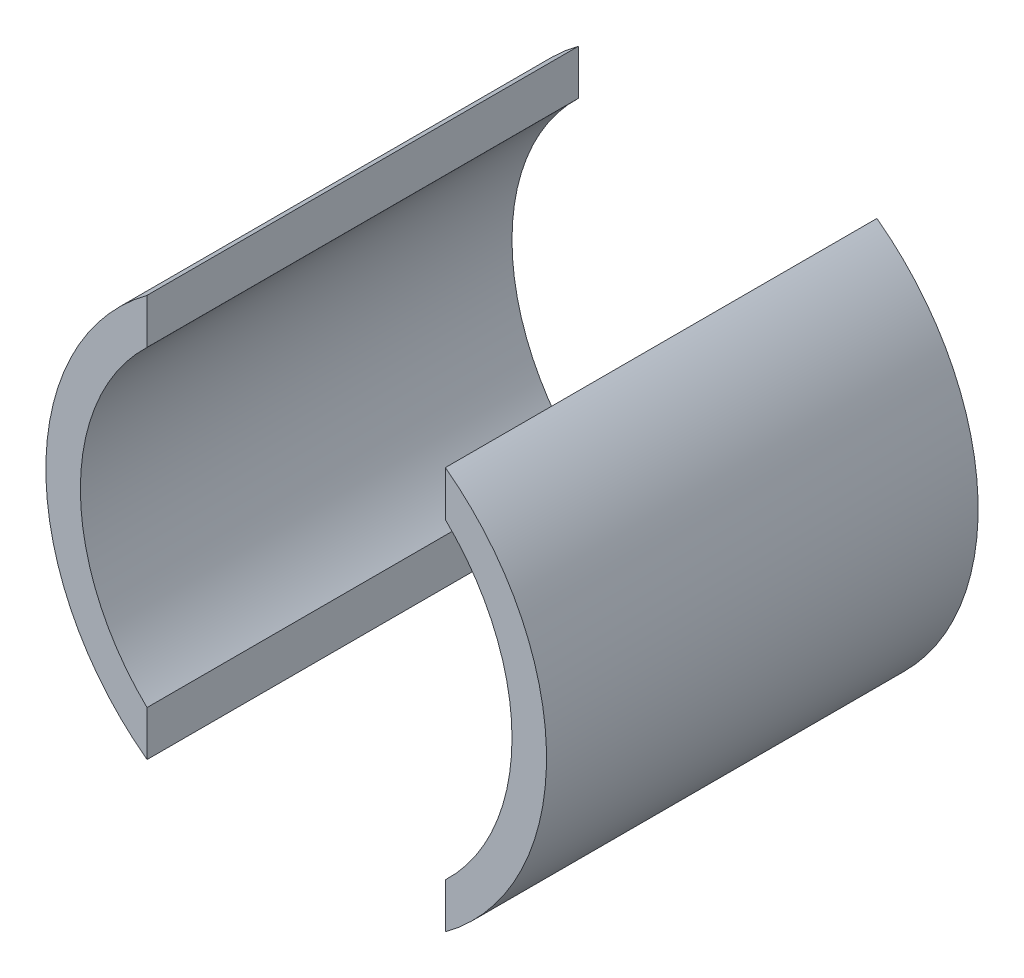
from build123d import *

# Parameters (mm, degrees)
BOSS_EXTRUDE1_DEPTH   = 50
BOSS_EXTRUDE1_2_DEPTH = 50


with BuildPart() as part:
    # Sketch1 → Boss-Extrude1 (new body)
    with BuildSketch(Plane.XY):
        with BuildLine():
            Line((-17.280821918, -18.065801777), (-17.280821918, -23.288907099))
            ThreePointArc((-17.280821918, -23.288907099), (-29, 0), (-17.280821918, 23.288907099))
            Line((-17.280821918, 23.288907099), (-17.280821918, 18.065801777))
            ThreePointArc((-17.280821918, 18.065801777), (-25, 0), (-17.280821918, -18.065801777))
        make_face()
    extrude(amount=BOSS_EXTRUDE1_DEPTH)


with BuildPart() as body_2:
    # Sketch1 → Boss-Extrude1 2 (new body)
    with BuildSketch(Plane.XY):
        with BuildLine():
            Line((17.280821918, 23.288907099), (17.280821918, 18.065801777))
            ThreePointArc((17.280821918, 18.065801777), (25, 0), (17.280821918, -18.065801777))
            Line((17.280821918, -18.065801777), (17.280821918, -23.288907099))
            ThreePointArc((17.280821918, -23.288907099), (29, 0), (17.280821918, 23.288907099))
        make_face()
    extrude(amount=BOSS_EXTRUDE1_2_DEPTH)


solid = Compound([part.part, body_2.part])
